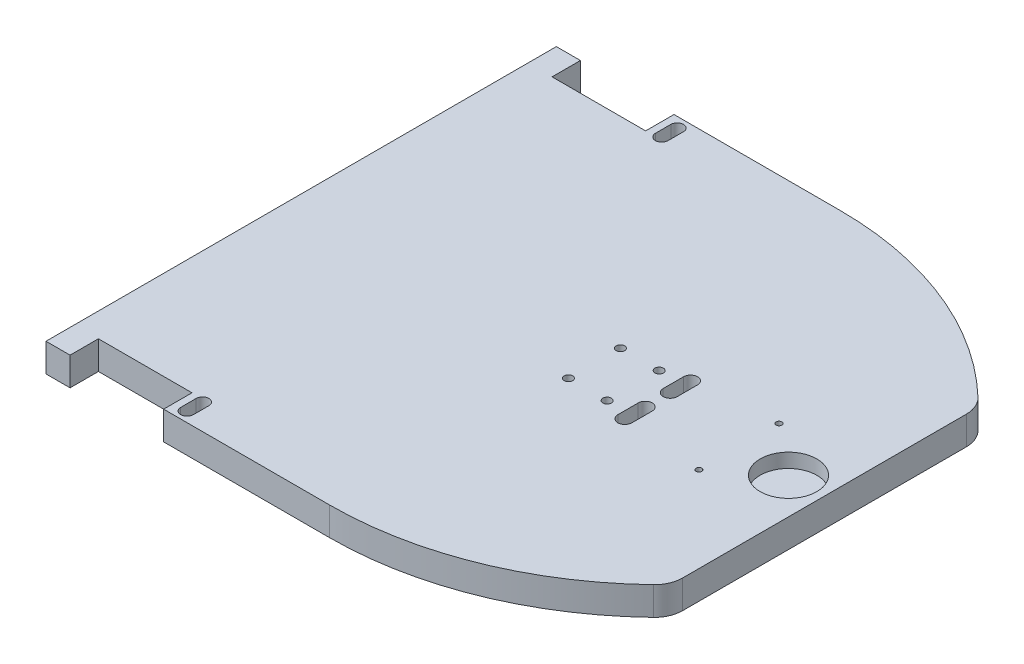
from build123d import *

# Parameters (mm, degrees)
BOSS_EXTRUDE1_DEPTH = 10
SKETCH2_R           = 1
SKETCH2_R_2         = 1.5
SKETCH2_W           = 33
SKETCH2_H           = 10
CUT_EXTRUDE2_DEPTH  = 15
SKETCH3_R           = 10
CUT_EXTRUDE3_DEPTH  = 5


with BuildPart() as part:
    # Sketch1 → Boss-Extrude1 (new body)
    with BuildSketch(Plane(origin=(0, 0, 0), x_dir=(1, 0, 0), z_dir=(0, 1, 0))):
        with BuildLine():
            Line((-89.389143795, -90), (-89.389143795, 90))
            Line((-89.389143795, 90), (10.610856205, 90))
            ThreePointArc((10.610856205, 90), (54.533138364, 81.496268076), (92.107774725, 57.214031174))
            ThreePointArc((92.107774725, 57.214031174), (94.381847518, 53.920998768), (95.182620993, 50))
            Line((95.182620993, 50), (95.182620993, -50))
            ThreePointArc((95.182620993, -50), (94.381847518, -53.920998768), (92.107774725, -57.214031174))
            ThreePointArc((92.107774725, -57.214031174), (54.533138364, -81.496268076), (10.610856205, -90))
            Line((10.610856205, -90), (-89.389143795, -90))
        make_face()
    extrude(amount=BOSS_EXTRUDE1_DEPTH)

    # Sketch2 → Cut-Extrude2 (cut, symmetric)
    with BuildSketch(Plane(origin=(0, 10, 0), x_dir=(1, 0, 0), z_dir=(0, 1, 0))):
        with Locations(Location((65, 14.131573434, 0), (0, 0, 90))):
            Circle(SKETCH2_R)
        with Locations(Location((27.688972694, 9.173126615, 0), (0, 0, 90))):
            Circle(SKETCH2_R_2)
        with Locations(Location((14.053243942, 9.173126615, 0), (0, 0, 90))):
            Circle(SKETCH2_R_2)
        with Locations(Location((14.053243942, -9.173126615, 0), (0, 0, 90))):
            Circle(SKETCH2_R_2)
        with Locations(Location((27.688972694, -9.173126615, 0), (0, 0, 90))):
            Circle(SKETCH2_R_2)
        with Locations(Location((65, -14.131573434, 0), (0, 0, 90))):
            Circle(SKETCH2_R)
        with BuildLine():
            Line((-40.968894473, 86.42714575), (-40.968894473, 80.97285425))
            ThreePointArc((-40.968894473, 80.97285425), (-43.204350858, 78.737397865), (-45.439807243, 80.97285425))
            Line((-45.439807243, 80.97285425), (-45.439807243, 86.42714575))
            ThreePointArc((-45.439807243, 86.42714575), (-43.204350858, 88.662602135), (-40.968894473, 86.42714575))
        make_face()
        with BuildLine():
            Line((38.845478036, 11.594873944), (38.845478036, 4.405126056))
            ThreePointArc((38.845478036, 4.405126056), (36.366254627, 1.925902647), (33.887031217, 4.405126056))
            Line((33.887031217, 4.405126056), (33.887031217, 11.594873944))
            ThreePointArc((33.887031217, 11.594873944), (36.366254627, 14.074097353), (38.845478036, 11.594873944))
        make_face()
        with Locations((-64.401012641, 85)):
            Rectangle(SKETCH2_W, SKETCH2_H)
        with BuildLine():
            Line((38.845478036, -11.594873944), (38.845478036, -4.405126056))
            ThreePointArc((38.845478036, -4.405126056), (36.366254627, -1.925902647), (33.887031217, -4.405126056))
            Line((33.887031217, -4.405126056), (33.887031217, -11.594873944))
            ThreePointArc((33.887031217, -11.594873944), (36.366254627, -14.074097353), (38.845478036, -11.594873944))
        make_face()
        with BuildLine():
            Line((-40.968894473, -86.42714575), (-40.968894473, -80.97285425))
            ThreePointArc((-40.968894473, -80.97285425), (-43.204350858, -78.737397865), (-45.439807243, -80.97285425))
            Line((-45.439807243, -80.97285425), (-45.439807243, -86.42714575))
            ThreePointArc((-45.439807243, -86.42714575), (-43.204350858, -88.662602135), (-40.968894473, -86.42714575))
        make_face()
        with Locations((-64.401012641, -85)):
            Rectangle(SKETCH2_W, SKETCH2_H)
    extrude(amount=CUT_EXTRUDE2_DEPTH, both=True, mode=Mode.SUBTRACT)

    # Sketch3 → Cut-Extrude3 (cut, symmetric)
    with BuildSketch(Plane(origin=(0, 10, 0), x_dir=(1, 0, 0), z_dir=(0, 1, 0))):
        with Locations(Location((82.479810043, 0, 0), (0, 0, 270))):
            Circle(SKETCH3_R)
    extrude(amount=CUT_EXTRUDE3_DEPTH, both=True, mode=Mode.SUBTRACT)


solid = part.part
